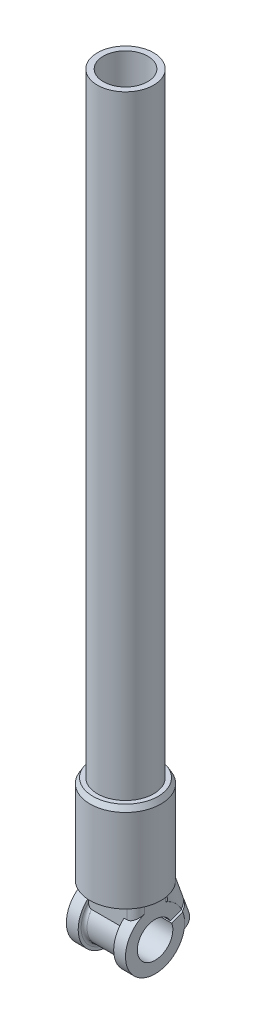
from build123d import *
from build123d.topology import SkipClean

# Parameters (mm, degrees)
BOSS_EXTRUDE3_REACH      = 61.641
BOSS_EXTRUDE3_END_RADIUS = 16
BOSS_EXTRUDE3_START      = 25
BOSS_EXTRUDE6_REACH      = 122.907
BOSS_EXTRUDE6_START      = -10
SKETCH12_R               = 3
CUT_EXTRUDE4_DEPTH       = 20
CUT_EXTRUDE5_DEPTH       = 101.189474959
SKETCH14_W               = 4
SKETCH14_H               = 475


with BuildPart() as part:
    # Sketch1 → Revolve1 (revolve)
    with BuildSketch(Plane.XY, mode=Mode.PRIVATE) as revolve1_sk:
        with BuildLine():
            Line((20, -12), (-20, -12))
            Line((-20, -12), (-20, -20))
            Line((-20, -20), (-12, -20))
            Line((-12, -20), (-12, -18))
            ThreePointArc((-12, -18), (-11.414213562, -16.585786438), (-10, -16))
            Line((-10, -16), (10, -16))
            ThreePointArc((10, -16), (11.414213562, -16.585786438), (12, -18))
            Line((12, -18), (12, -20))
            Line((12, -20), (20, -20))
            Line((20, -20), (20, -12))
        make_face()
    revolve(revolve1_sk.sketch.rotate(Axis((-0.797938443, 0, 0), (-1, 0, 0)), 270), axis=Axis((-0.797938443, 0, 0), (-1, 0, 0)))

    # Boss-Extrude3: up to this cylinder (the profile starts outside it)
    boss_extrude3_end = Plane(origin=(0, 0, 0), z_dir=(1, 0, 0)) * Cylinder(BOSS_EXTRUDE3_END_RADIUS, 156.282, mode=Mode.PRIVATE)
    # Sketch3 → Boss-Extrude3 (add, up to the surface)
    with BuildSketch(Plane(origin=(0, 0, 0), x_dir=(1, 0, 0), z_dir=(0, 1, 0)).offset(BOSS_EXTRUDE3_START), mode=Mode.PRIVATE) as boss_extrude3_sk1:
        with BuildLine():
            Line((-14, -13), (14, -13))
            ThreePointArc((14, -13), (18.242640687, -11.242640687), (20, -7))
            Line((20, -7), (20, 7))
            ThreePointArc((20, 7), (18.242640687, 11.242640687), (14, 13))
            Line((14, 13), (-14, 13))
            ThreePointArc((-14, 13), (-18.242640687, 11.242640687), (-20, 7))
            Line((-20, 7), (-20, -7))
            ThreePointArc((-20, -7), (-18.242640687, -11.242640687), (-14, -13))
        make_face()
    boss_extrude3_tool1 = extrude(boss_extrude3_sk1.sketch, amount=-BOSS_EXTRUDE3_REACH, mode=Mode.PRIVATE) - boss_extrude3_end
    add(boss_extrude3_tool1.solids().sort_by_distance((0, 25, 0))[0])

    # Sketch7 → Revolve2 (revolve)
    with BuildSketch(Plane.XY, mode=Mode.PRIVATE) as revolve2_sk:
        Polygon((0, 25), (-19, 25), (-19, 85), (-22, 85), (-24, 81.535898385), (-24, 25), (-10, 17), (0, 17), align=None)
    revolve(revolve2_sk.sketch.rotate(Axis((0, 17, 0), (0, 1, 0)), 180), axis=Axis((0, 17, 0), (0, 1, 0)))

    # Boss-Extrude6: up to this cone (the profile starts outside it)
    boss_extrude6_end = Plane(origin=(0, -3.625742, 0), z_dir=(0, 1, 0)).offset(14.911457286) * Cone(1.75e-06, 189.8672015, 108.495542714, align=(Align.CENTER, Align.CENTER, Align.MIN), mode=Mode.PRIVATE)
    # Sketch11 → Boss-Extrude6 (add, up to the surface)
    with BuildSketch(Plane(origin=(0, -18.793852416, -6.840402867), x_dir=(1, 0, 0), z_dir=(0, -0.9396926207859094, -0.34202014332566616)).offset(BOSS_EXTRUDE6_START), mode=Mode.PRIVATE) as boss_extrude6_sk1:
        with BuildLine():
            ThreePointArc((0, -23.198369278), (20, -16.873813958), (0, -10.549258637))
            ThreePointArc((0, -10.549258637), (-20, -16.873813958), (0, -23.198369278))
        make_face()
    boss_extrude6_tool1 = extrude(boss_extrude6_sk1.sketch, amount=-BOSS_EXTRUDE6_REACH, mode=Mode.PRIVATE) - boss_extrude6_end
    add(boss_extrude6_tool1.solids().sort_by_distance((0, -3.625742, -19.2764))[0])

    # Sketch12 → Cut-Extrude4 (cut)
    with BuildSketch(Plane(origin=(0, -9.396926208, -3.420201433), x_dir=(1, 0, 0), z_dir=(0, -0.9396926207859093, -0.34202014332566627))):
        with Locations(Location((-9, -21.198369278, 0), (0, 0, 270))):
            Circle(SKETCH12_R)
        with Locations(Location((9, -21.198369278, 0), (0, 0, 270))):
            Circle(SKETCH12_R)
    extrude(amount=-CUT_EXTRUDE4_DEPTH, mode=Mode.SUBTRACT)

    # Sketch13 → Cut-Extrude5 (cut, through all)
    with SkipClean():  # the faces are left unmerged after this step: merging them gives an invalid solid
        with BuildSketch(Plane.ZY.offset(20)):
            with BuildLine():
                Line((-11.276311449, 4.10424172), (-26.311393382, 9.576564013))
                Line((-26.311393382, 9.576564013), (-25.627353095, 11.455949255))
                Line((-25.627353095, 11.455949255), (-10.434552746, 5.926222152))
                ThreePointArc((-10.434552746, 5.926222152), (10.89359028, -5.032861095), (-11.276311449, 4.10424172))
            make_face()
        extrude(amount=-CUT_EXTRUDE5_DEPTH, mode=Mode.SUBTRACT)


with BuildPart() as body_2:
    # Sketch14 → Revolve3 (revolve)
    with BuildSketch(Plane(origin=(0, 0, 0), x_dir=(0, 0, -1), z_dir=(1, 0, 0)), mode=Mode.PRIVATE) as revolve3_sk:
        with Locations((-17, 262.5)):
            Rectangle(SKETCH14_W, SKETCH14_H)
    revolve(revolve3_sk.sketch.rotate(Axis((0, 0, 0), (0, 1, 0)), 180), axis=Axis((0, 0, 0), (0, 1, 0)))


solid = Compound([part.part, body_2.part])
